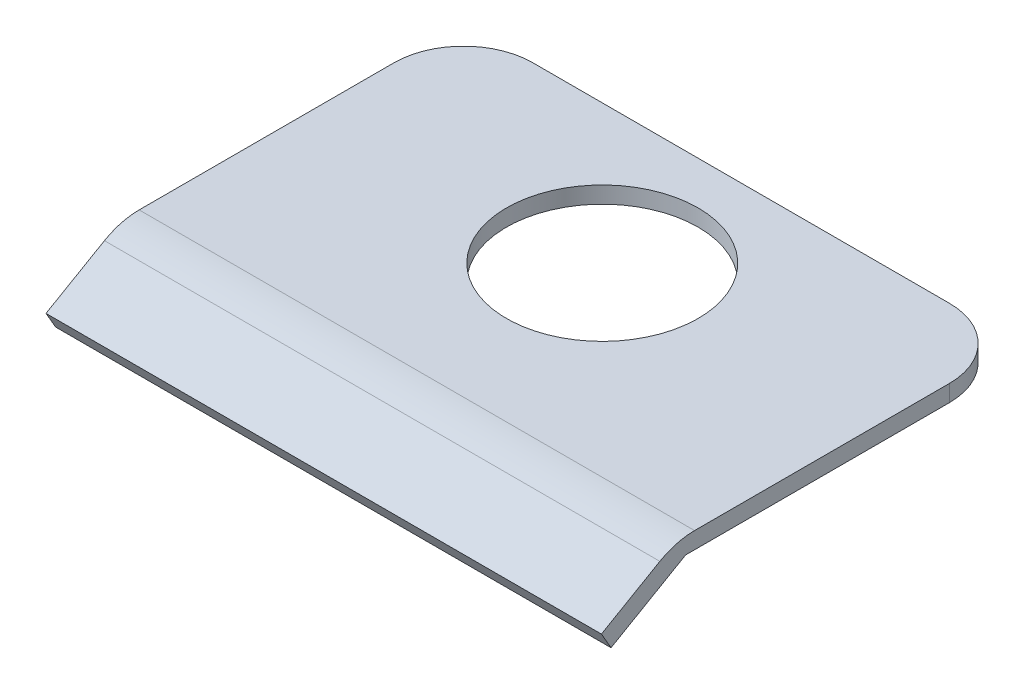
from build123d import *

# Parameters (mm, degrees)
SKETCH1_W           = 50.8
SKETCH1_H           = 30.48
SKETCH1_R           = 8.763
BOSS_EXTRUDE1_DEPTH = 1.524
BOSS_EXTRUDE2_DEPTH = 50.8
FILLET1_R           = 6.35


with BuildPart() as part:
    # Sketch1 → Boss-Extrude1 (new body)
    with BuildSketch(Plane(origin=(0, 0, 0), x_dir=(1, 0, 0), z_dir=(0, 1, 0))):
        Rectangle(SKETCH1_W, SKETCH1_H)
        with Locations(Location((0, 2.54, 0), (0, 0, 90))):
            Circle(SKETCH1_R, mode=Mode.SUBTRACT)
    extrude(amount=BOSS_EXTRUDE1_DEPTH)

    # Sketch2 → Boss-Extrude2 (add)
    with BuildSketch(Plane.ZY.offset(25.4)):
        Polygon((15.24, 0), (22.059084029, -3.937), (22.93896584, -2.413), (16.11988181, 1.524), (15.24, 1.524), align=None)
    extrude(amount=-BOSS_EXTRUDE2_DEPTH)

    # Fillet1
    fillet1_edges = [part.edges().sort_by_distance(p)[0] for p in [
        (0, 1.524, 16.11988181),
        (-25.4, 0.762, -15.24),
        (25.4, 0.762, -15.24),
    ]]
    fillet(fillet1_edges, radius=FILLET1_R)


solid = part.part
